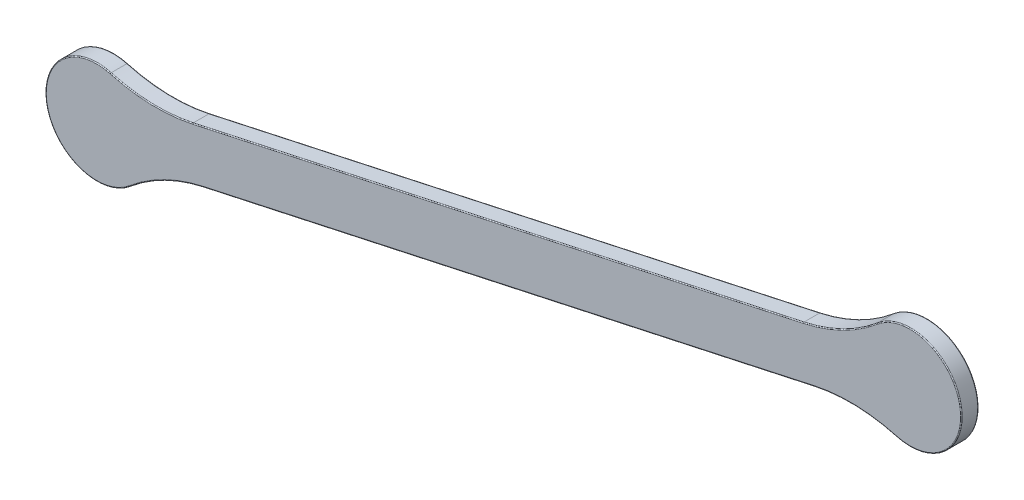
from build123d import *

# Parameters (mm, degrees)
SKETCH_1_R      = 9
EXTRUDE_1_DEPTH = 3
FILLET_1_R      = 30
FILLET_2_R      = 0.15


with BuildPart() as part:
    # 草图1 → 凸台-拉伸1 (new body)
    with BuildSketch(Plane.XY):
        with Locations((-244.136401891, 191.197879466)):
            Circle(SKETCH_1_R)
        with Locations((-101.472478495, 222.230200701)):
            Circle(SKETCH_1_R)
        with BuildLine():
            Line((-100.516002841, 217.833024979), (-243.179926237, 186.800703745))
            ThreePointArc((-243.179926237, 186.800703745), (-248.533577612, 190.241403811), (-245.092877546, 195.595055187))
            Line((-245.092877546, 195.595055187), (-102.42895415, 226.627376422))
            ThreePointArc((-102.42895415, 226.627376422), (-97.075302774, 223.186676355), (-100.516002841, 217.833024979))
        make_face()
    extrude(amount=-EXTRUDE_1_DEPTH)

    # 圆角1
    fillet_1_edges = [part.edges().sort_by_distance(p)[0] for p in [
        (-108.132134599, 216.17636055, -1.5),
        (-235.563794478, 188.457368174, -1.5),
        (-237.476745787, 197.251719617, -1.5),
        (-110.045085908, 224.970711992, -1.5),
    ]]
    fillet(fillet_1_edges, radius=FILLET_1_R)

    # 圆角2
    fillet_2_edges = [part.edges().sort_by_distance(p)[0] for p in [
        (-173.760915848, 211.111215804, 0),
        (-173.760915848, 211.111215804, -3),
        (-252.930753333, 189.284928157, 0),
        (-252.930753333, 189.284928157, -3),
        (-171.847964539, 202.316864362, 0),
        (-171.847964539, 202.316864362, -3),
        (-92.678127053, 224.14315201, 0),
        (-92.678127053, 224.14315201, -3),
        (-234.549689719, 198.787190778, 0),
        (-234.549689719, 198.787190778, -3),
        (-232.263398459, 188.276495212, 0),
        (-232.263398459, 188.276495212, -3),
        (-111.059190667, 214.640889389, 0),
        (-111.059190667, 214.640889389, -3),
        (-113.345481927, 225.151584954, 0),
        (-113.345481927, 225.151584954, -3),
    ]]
    fillet(fillet_2_edges, radius=FILLET_2_R)


solid = part.part
